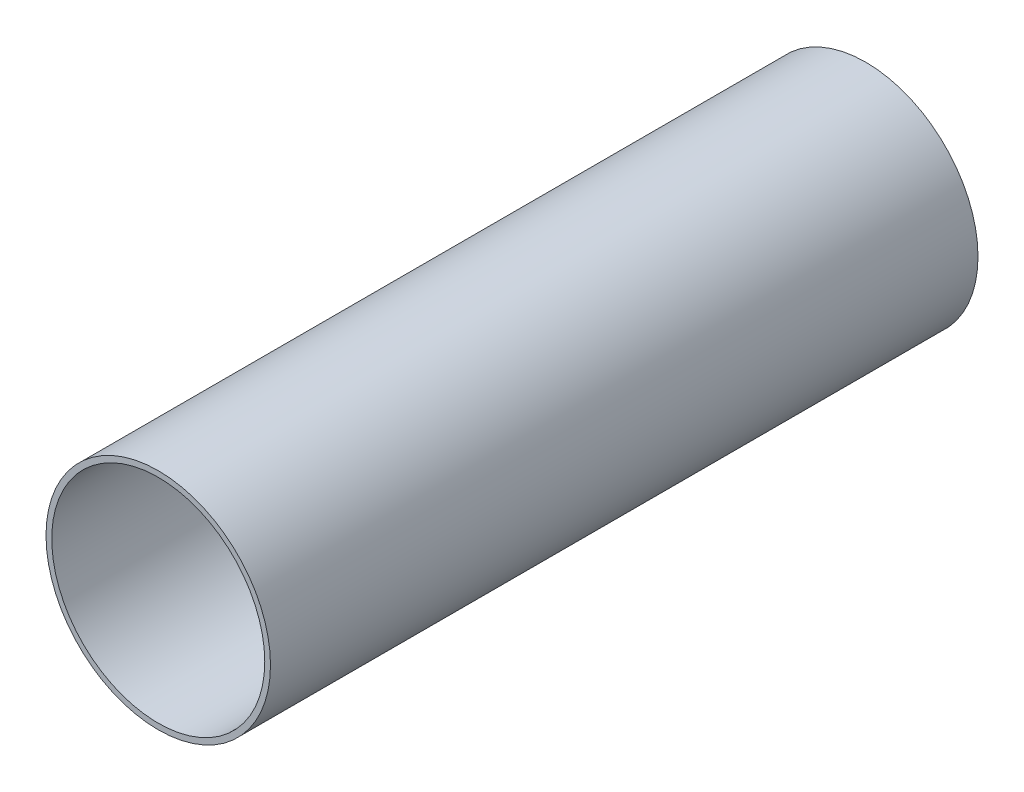
from build123d import *

# Parameters (mm, degrees)
SKETCH1_R           = 29.35
SKETCH1_R_2         = 27.85
BOSS_EXTRUDE1_DEPTH = 185


with BuildPart() as part:
    # Sketch1 → Boss-Extrude1 (new body)
    with BuildSketch(Plane.XY):
        Circle(SKETCH1_R)
        Circle(SKETCH1_R_2, mode=Mode.SUBTRACT)
    extrude(amount=BOSS_EXTRUDE1_DEPTH)


solid = part.part
